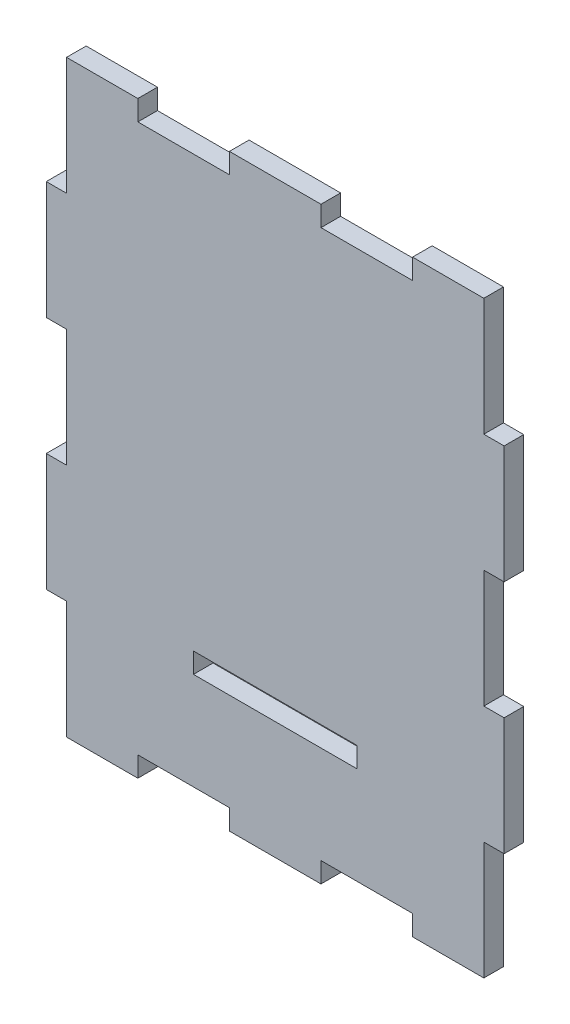
from build123d import *

# Parameters (mm, degrees)
SALIENTE_EXTRUIR1_DEPTH = 1.5
CROQUIS2_W              = 25
CROQUIS2_H              = 3.1
CORTAR_EXTRUIR1_DEPTH   = 10


with BuildPart() as part:
    # Croquis1 → Saliente-Extruir1 (new, symmetric)
    with BuildSketch(Plane.XY):
        Polygon((-31.9, -27), (-31.9, -45), (-21, -45), (-21, -41.9), (-7, -41.9), (-7, -45), (7, -45), (7, -41.9), (21, -41.9), (21, -45), (31.9, -45), (31.9, -27), (35, -27), (35, -9), (31.9, -9), (31.9, 9), (35, 9), (35, 27), (31.9, 27), (31.9, 45), (21, 45), (21, 41.9), (7, 41.9), (7, 45), (-7, 45), (-7, 41.9), (-21, 41.9), (-21, 45), (-31.9, 45), (-31.9, 27), (-35, 27), (-35, 9), (-31.9, 9), (-31.9, -9), (-35, -9), (-35, -27), align=None)
    extrude(amount=SALIENTE_EXTRUIR1_DEPTH, both=True)

    # Croquis2 → Cortar-Extruir1 (cut)
    with BuildSketch(Plane(origin=(0, 0, -1.5), x_dir=(-1, 0, 0), z_dir=(0, 0, -1))):
        with Locations((0, -25.45)):
            Rectangle(CROQUIS2_W, CROQUIS2_H)
    extrude(amount=-CORTAR_EXTRUIR1_DEPTH, mode=Mode.SUBTRACT)


solid = part.part
